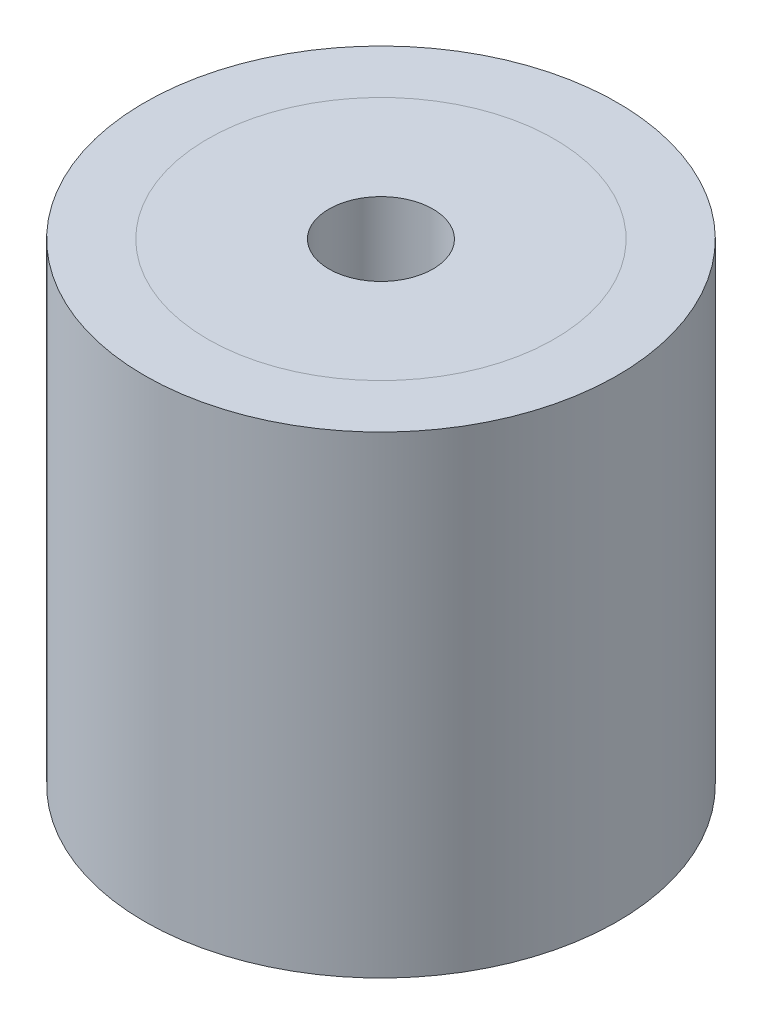
from build123d import *

# Parameters (mm, degrees)
SKETCH_1_R             = 7.5
EXTRUDE_1_DEPTH        = 7.5
HOLE_WIZARD_M4_1_D     = 3.3
HOLE_WIZARD_M4_1_DEPTH = 21.5
HOLE_WIZARD_M4_1_TIP   = 0.991420021


with BuildPart() as part:
    # 草图1 → 凸台-拉伸1 (new, symmetric)
    with BuildSketch(Plane(origin=(0, 0, 0), x_dir=(1, 0, 0), z_dir=(0, 1, 0))):
        with Locations(Location((0, 0, 0), (0, 0, 270))):
            Circle(SKETCH_1_R)
    extrude(amount=EXTRUDE_1_DEPTH, both=True)

    # M4 螺纹孔1
    with Locations(Plane(origin=(0, 7.5, 0), x_dir=(1, 0, 0), z_dir=(0, 1, 0))):
        with Locations((0, 0)):
            Hole(HOLE_WIZARD_M4_1_D / 2, depth=HOLE_WIZARD_M4_1_DEPTH)
            with Locations((0, 0, -(HOLE_WIZARD_M4_1_DEPTH + HOLE_WIZARD_M4_1_TIP / 2))):  # 118° drill point
                Cone(0, HOLE_WIZARD_M4_1_D / 2, HOLE_WIZARD_M4_1_TIP, mode=Mode.SUBTRACT)


solid = part.part
